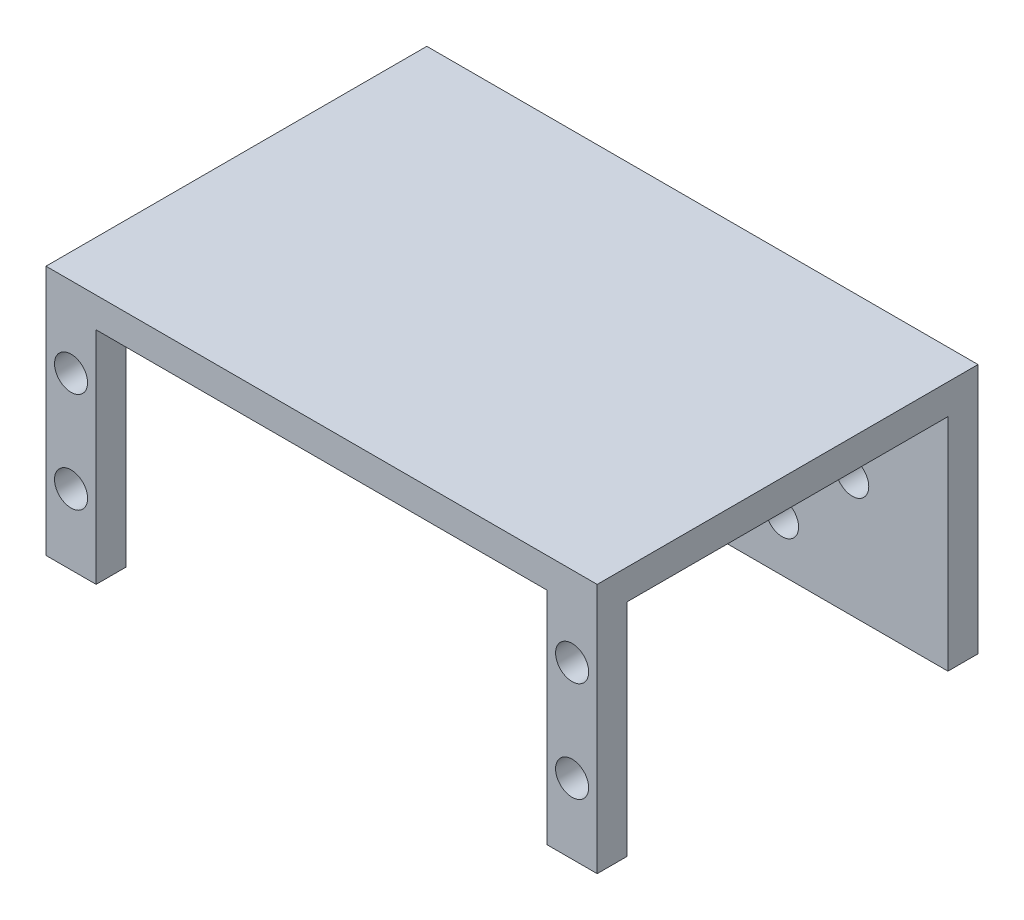
from build123d import *

# Parameters (mm, degrees)
SKETCH_1_W          = 55
SKETCH_1_H          = 25
EXTRUDE_1_DEPTH     = 3
SKETCH_2_W          = 55
SKETCH_2_H          = 3
EXTRUDE_2_DEPTH     = 35
SKETCH_3_W          = 5
SKETCH_3_H          = 3
EXTRUDE_3_DEPTH     = 22
CUT_EXTRUDE_1_REACH = 50.544
SKETCH_4_R          = 1.65
SKETCH_7_R          = 1.65
CUT_EXTRUDE_2_DEPTH = 20


with BuildPart() as part:
    # 草图1 → 凸台-拉伸1 (new body)
    with BuildSketch(Plane.XY):
        Rectangle(SKETCH_1_W, SKETCH_1_H)
    extrude(amount=EXTRUDE_1_DEPTH)

    # 草图2 → 凸台-拉伸2 (add)
    with BuildSketch(Plane.XY.offset(3)):
        with Locations((0, 11)):
            Rectangle(SKETCH_2_W, SKETCH_2_H)
    extrude(amount=EXTRUDE_2_DEPTH)

    # 草图3 → 凸台-拉伸3 (add)
    with BuildSketch(Plane.XZ.offset(-9.5)):
        with Locations((-25, 36.5)):
            Rectangle(SKETCH_3_W, SKETCH_3_H)
        with Locations((25, 36.5)):
            Rectangle(SKETCH_3_W, SKETCH_3_H)
    extrude(amount=EXTRUDE_3_DEPTH)

    # 草图4 → 切除-拉伸1 (cut, up to next)
    with BuildSketch(Plane.XY.offset(38), mode=Mode.PRIVATE) as cut_extrude_1_sk1:
        with Locations((-25, -5.5)):
            Circle(SKETCH_4_R)
    cut_extrude_1_tool1 = extrude(cut_extrude_1_sk1.sketch, amount=-CUT_EXTRUDE_1_REACH, mode=Mode.PRIVATE) & part.part
    # 草图4 → 切除-拉伸1 (cut, up to next)
    with BuildSketch(Plane.XY.offset(38), mode=Mode.PRIVATE) as cut_extrude_1_sk2:
        with Locations((-25, 4.5)):
            Circle(SKETCH_4_R)
    cut_extrude_1_tool2 = extrude(cut_extrude_1_sk2.sketch, amount=-CUT_EXTRUDE_1_REACH, mode=Mode.PRIVATE) & part.part
    # 草图4 → 切除-拉伸1 (cut, up to next)
    with BuildSketch(Plane.XY.offset(38), mode=Mode.PRIVATE) as cut_extrude_1_sk3:
        with Locations((25, 4.5)):
            Circle(SKETCH_4_R)
    cut_extrude_1_tool3 = extrude(cut_extrude_1_sk3.sketch, amount=-CUT_EXTRUDE_1_REACH, mode=Mode.PRIVATE) & part.part
    # 草图4 → 切除-拉伸1 (cut, up to next)
    with BuildSketch(Plane.XY.offset(38), mode=Mode.PRIVATE) as cut_extrude_1_sk4:
        with Locations((25, -5.5)):
            Circle(SKETCH_4_R)
    cut_extrude_1_tool4 = extrude(cut_extrude_1_sk4.sketch, amount=-CUT_EXTRUDE_1_REACH, mode=Mode.PRIVATE) & part.part
    add(cut_extrude_1_tool1.solids().sort_by_distance((-25, -5.5, 38))[0], mode=Mode.SUBTRACT)
    add(cut_extrude_1_tool2.solids().sort_by_distance((-25, 4.5, 38))[0], mode=Mode.SUBTRACT)
    add(cut_extrude_1_tool3.solids().sort_by_distance((25, 4.5, 38))[0], mode=Mode.SUBTRACT)
    add(cut_extrude_1_tool4.solids().sort_by_distance((25, -5.5, 38))[0], mode=Mode.SUBTRACT)

    # 草图7 → 切除-拉伸2 (cut)
    with BuildSketch(Plane.XY.offset(3)):
        with Locations((17.95, -0.5)):
            Circle(SKETCH_7_R)
        with Locations((10.95, 6.5)):
            Circle(SKETCH_7_R)
        with Locations((3.95, -0.5)):
            Circle(SKETCH_7_R)
        with Locations((10.95, -7.5)):
            Circle(SKETCH_7_R)
    extrude(amount=-CUT_EXTRUDE_2_DEPTH, mode=Mode.SUBTRACT)


solid = part.part
